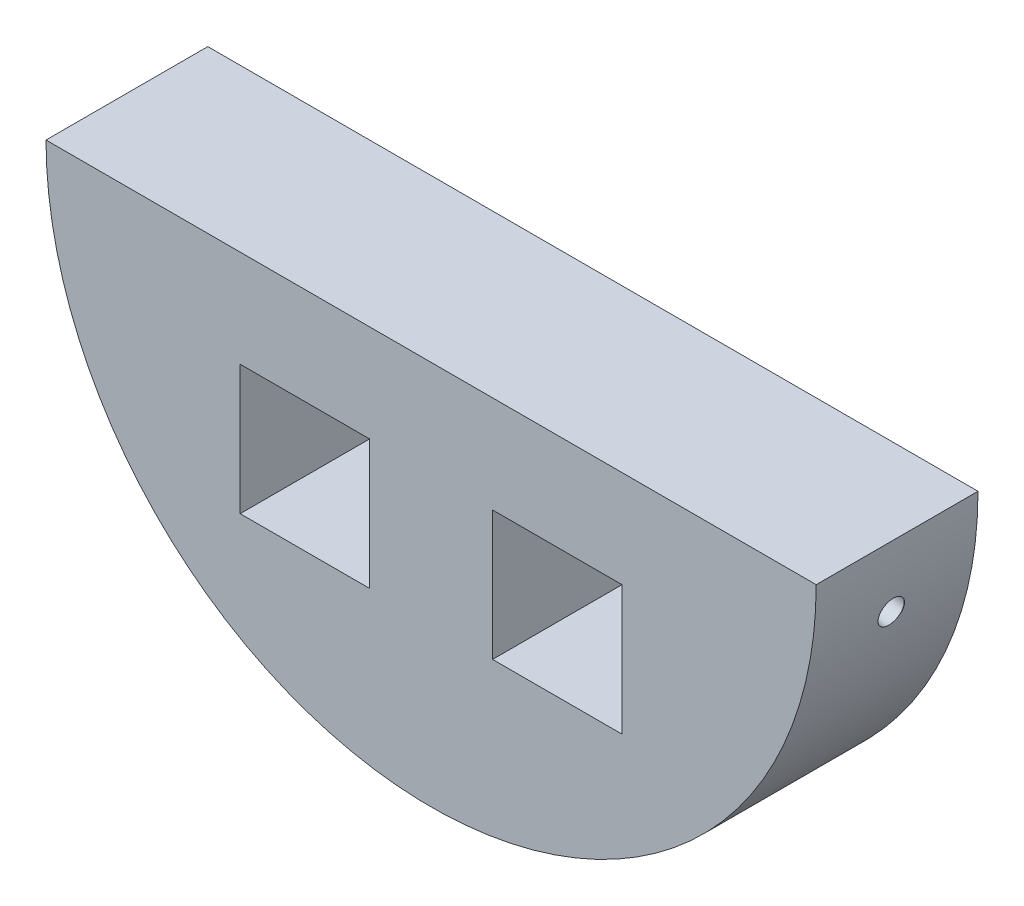
from build123d import *

# Parameters (mm, degrees)
SKETCH1_W           = 20
SKETCH1_H           = 20
BOSS_EXTRUDE1_DEPTH = 25
CIRPATTERN1_COUNT   = 5
CIRPATTERN1_ANGLE   = 160


with BuildPart() as part:
    # Sketch1 → Boss-Extrude1 (new body)
    with BuildSketch(Plane.XY):
        with BuildLine():
            Line((-119, 0), (0, 0))
            ThreePointArc((0, 0), (-59.5, -59.5), (-119, 0))
        make_face()
        with Locations((-40, -25)):
            Rectangle(SKETCH1_W, SKETCH1_H, mode=Mode.SUBTRACT)
        with Locations((-79, -25)):
            Rectangle(SKETCH1_W, SKETCH1_H, mode=Mode.SUBTRACT)
    extrude(amount=BOSS_EXTRUDE1_DEPTH)

    # Sketch4 → Ø4.0mm Dowel Hole2 (revolve, cut)
    with BuildSketch(Plane(origin=(-0.903938696, -10.332066571, 12.5), x_dir=(0.1736481776669305, 0.9848077530122081, 0), z_dir=(0, 0, 1))):
        Polygon((0, 0), (0, 11.201721238), (2, 10), (2, 0.025), (2.025, 0), align=None)
    f_4_0mm_dowel_hole2 = revolve(axis=Axis((5.349590536, -11.434732499, 12.5), (-0.9848077530122081, 0.1736481776669305, 0)), mode=Mode.SUBTRACT)

    # CirPattern1: Ø4.0mm Dowel Hole2 ×5 about axis
    cirpattern1_axis = Axis((-59.5, 0, 0), (0, 0, -1))
    for i in range(1, CIRPATTERN1_COUNT):
        add(f_4_0mm_dowel_hole2.rotate(cirpattern1_axis, i * CIRPATTERN1_ANGLE / (CIRPATTERN1_COUNT - 1)), mode=Mode.SUBTRACT)


solid = part.part
